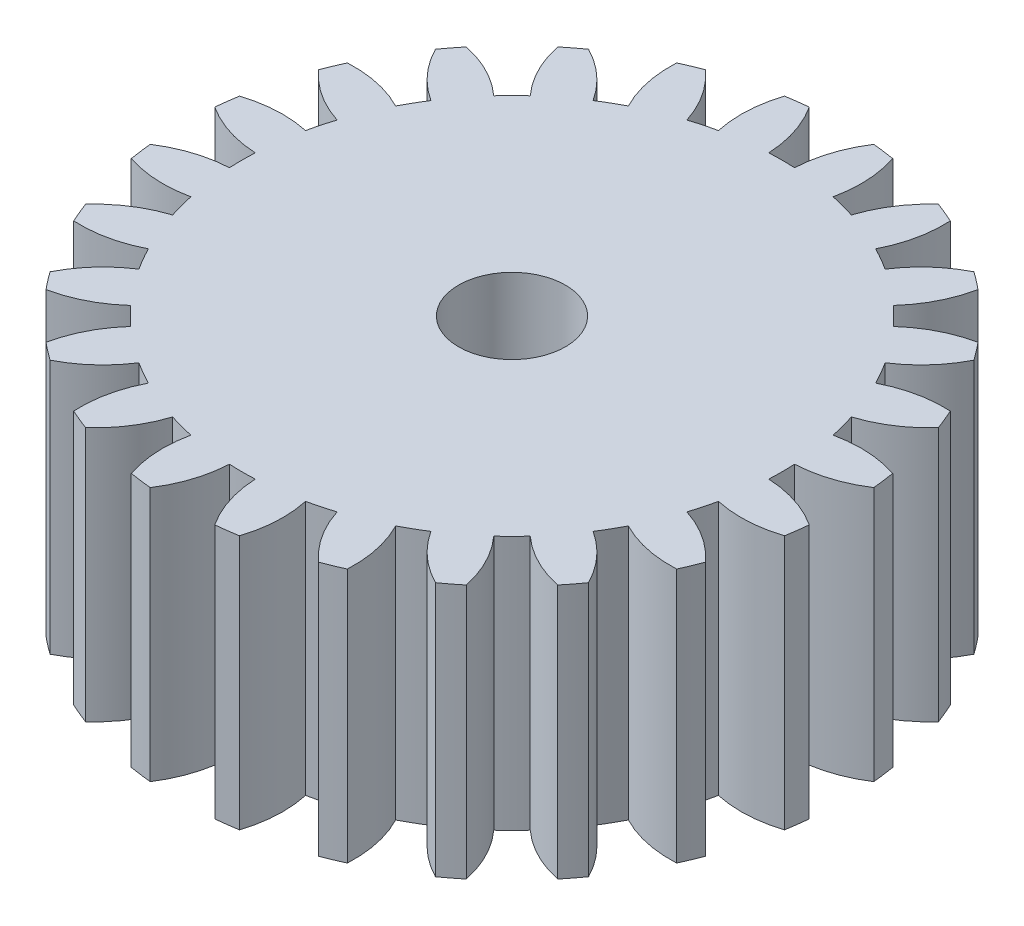
from build123d import *

# Parameters (mm, degrees)
SKETCH1_R               = 6.5
SKETCH1_R_2             = 6
SKETCH1_R_3             = 5.3
BOSS_EXTRUDE1_DEPTH     = 2.5
CUT_EXTRUDE1_DEPTH      = 10.526279442
CIRPATTERN1_COUNT       = 24
CUT_EXTRUDE2_DEPTH      = 10.48407185
CUT_EXTRUDE2_DEPTH_BACK = 10.48407185
SKETCH4_R               = 1.05


with BuildPart() as part:
    # Sketch1 → Boss-Extrude1 (new, symmetric)
    # profile 1 of 3: a face of its own
    with BuildSketch(Plane(origin=(0, 0, 0), x_dir=(1, 0, 0), z_dir=(0, 1, 0))):
        with Locations(Location((0, 0, 0), (0, 0, 270))):
            Circle(SKETCH1_R)
        Circle(SKETCH1_R_2, mode=Mode.SUBTRACT)
    # profile 2 of 3: a face of its own
    with BuildSketch(Plane(origin=(0, 0, 0), x_dir=(1, 0, 0), z_dir=(0, 1, 0))):
        Circle(SKETCH1_R_2)
        Circle(SKETCH1_R_3, mode=Mode.SUBTRACT)
    # profile 3 of 3: a face of its own
    with BuildSketch(Plane(origin=(0, 0, 0), x_dir=(1, 0, 0), z_dir=(0, 1, 0))):
        Circle(SKETCH1_R_3)
    extrude(amount=BOSS_EXTRUDE1_DEPTH, both=True)

    # Sketch3 → Cut-Extrude1 (cut, symmetric)
    with BuildSketch(Plane(origin=(0, 0, 0), x_dir=(1, 0, 0), z_dir=(0, 1, 0))):
        with BuildLine():
            ThreePointArc((-2.097447593, 7.48155155), (-0.805034356, 6.699886195), (-0.253044756, 5.293955832))
            ThreePointArc((-0.253044756, 5.293955832), (0, 5.3), (0.253044756, 5.293955832))
            ThreePointArc((0.253044756, 5.293955832), (0.805034356, 6.699886195), (2.097447593, 7.48155155))
            ThreePointArc((2.097447593, 7.48155155), (0, 7.77), (-2.097447593, 7.48155155))
        make_face()
    cut_extrude1 = extrude(amount=CUT_EXTRUDE1_DEPTH, both=True, mode=Mode.SUBTRACT)

    # CirPattern1: Cut-Extrude1 ×24 about axis
    cirpattern1_axis = Axis((0, 0, 0), (0, 1, 0))
    for i in range(1, CIRPATTERN1_COUNT):
        add(cut_extrude1.rotate(cirpattern1_axis, i * 360 / CIRPATTERN1_COUNT), mode=Mode.SUBTRACT)

    # Sketch4 → Cut-Extrude2 (cut, two sides: drawn at the far end of the back side and taken through both)
    with BuildSketch(Plane(origin=(0, 0, 0), x_dir=(1, 0, 0), z_dir=(0, 1, 0)).offset(-CUT_EXTRUDE2_DEPTH_BACK)):
        with Locations(Location((0, 0, 0), (0, 0, 270))):
            Circle(SKETCH4_R)
    extrude(amount=CUT_EXTRUDE2_DEPTH + CUT_EXTRUDE2_DEPTH_BACK, mode=Mode.SUBTRACT)


solid = part.part
